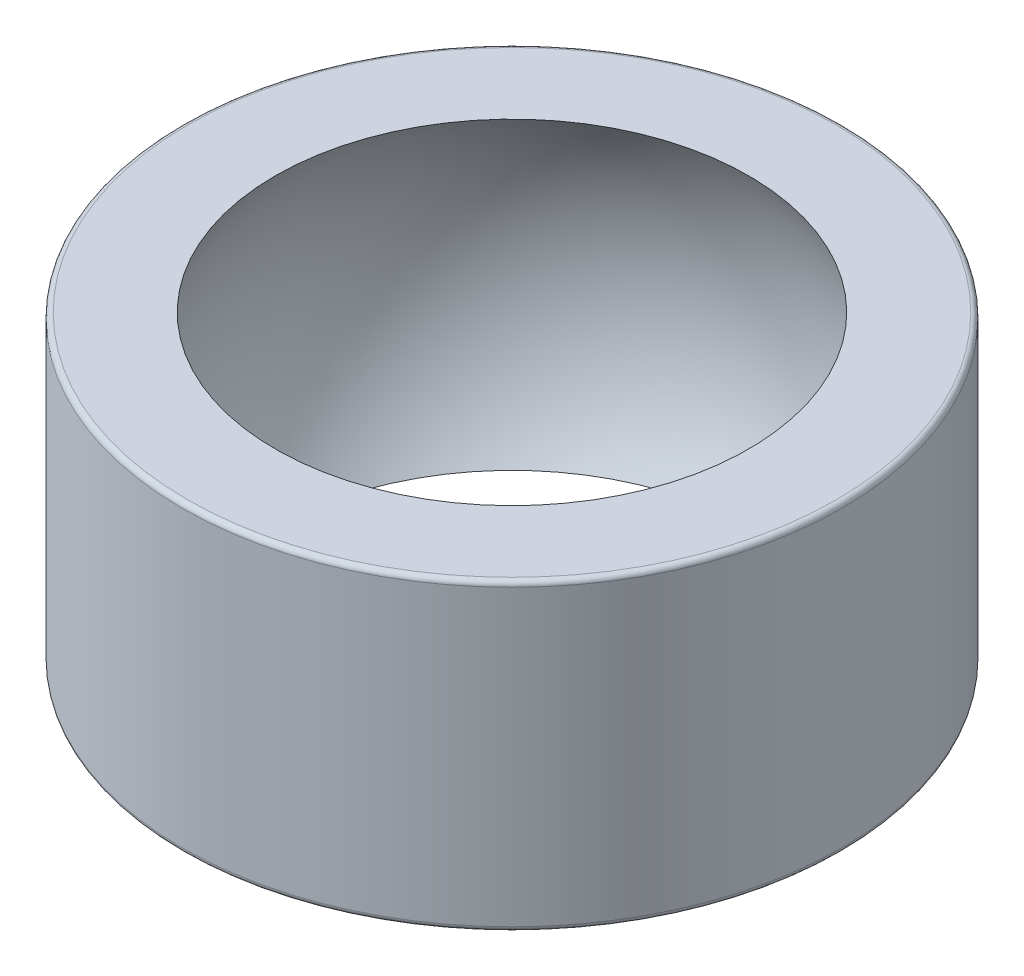
from build123d import *

# Parameters (mm, degrees)
SZKIC1_R                    = 13
DODANIE_WYCI_GNI_CIE1_DEPTH = 6
ZAOKR_GLENIE1_R             = 0.2


with BuildPart() as part:
    # Szkic1 → Dodanie-wyciągnięcie1 (new, symmetric)
    with BuildSketch(Plane(origin=(0, 0, 0), x_dir=(1, 0, 0), z_dir=(0, 1, 0))):
        with Locations(Location((0, 0, 0), (0, 0, 270))):
            Circle(SZKIC1_R)
    extrude(amount=DODANIE_WYCI_GNI_CIE1_DEPTH, both=True)

    # Szkic3 → Wycięcie-obrót1 (revolve, cut)
    with BuildSketch(Plane.XY):
        with BuildLine():
            Line((0, -11.1), (0, 11.1))
            ThreePointArc((0, 11.1), (11.1, 0), (0, -11.1))
        make_face()
    revolve(axis=Axis((0, -11.1, 0), (0, 1, 0)), mode=Mode.SUBTRACT)

    # Zaokrąglenie1
    zaokr_glenie1_edges = [part.edges().sort_by_distance(p)[0] for p in [
        (0, -6, -13),
        (0, 6, -13),
    ]]
    fillet(zaokr_glenie1_edges, radius=ZAOKR_GLENIE1_R)


solid = part.part
